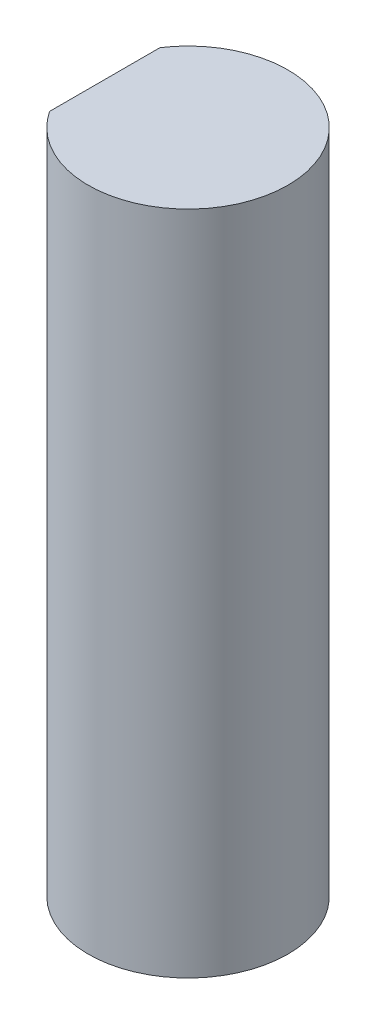
from build123d import *

# Parameters (mm, degrees)
BOSS_EXTRUDE1_DEPTH = 20


with BuildPart() as part:
    # Sketch1 → Boss-Extrude1 (new body)
    with BuildSketch(Plane(origin=(0, 0, 0), x_dir=(1, 0, 0), z_dir=(0, 1, 0))):
        with BuildLine():
            Line((-2.5, 1.658312395), (-2.5, -1.658312395))
            ThreePointArc((-2.5, -1.658312395), (3, 0), (-2.5, 1.658312395))
        make_face()
    extrude(amount=BOSS_EXTRUDE1_DEPTH)


solid = part.part
